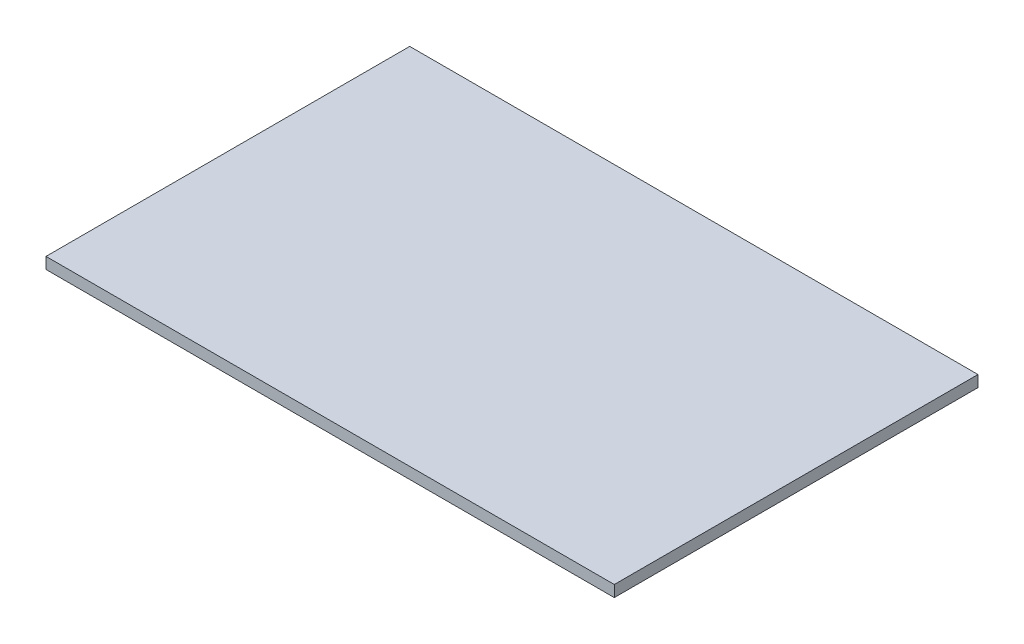
from build123d import *

# Parameters (mm, degrees)
SKETCH1_W           = 158.75
SKETCH1_H           = 101.6
BOSS_EXTRUDE1_DEPTH = 3.175


with BuildPart() as part:
    # Sketch1 → Boss-Extrude1 (new body)
    with BuildSketch(Plane(origin=(0, 0, 0), x_dir=(1, 0, 0), z_dir=(0, 1, 0))):
        Rectangle(SKETCH1_W, SKETCH1_H)
    extrude(amount=BOSS_EXTRUDE1_DEPTH)


solid = part.part
